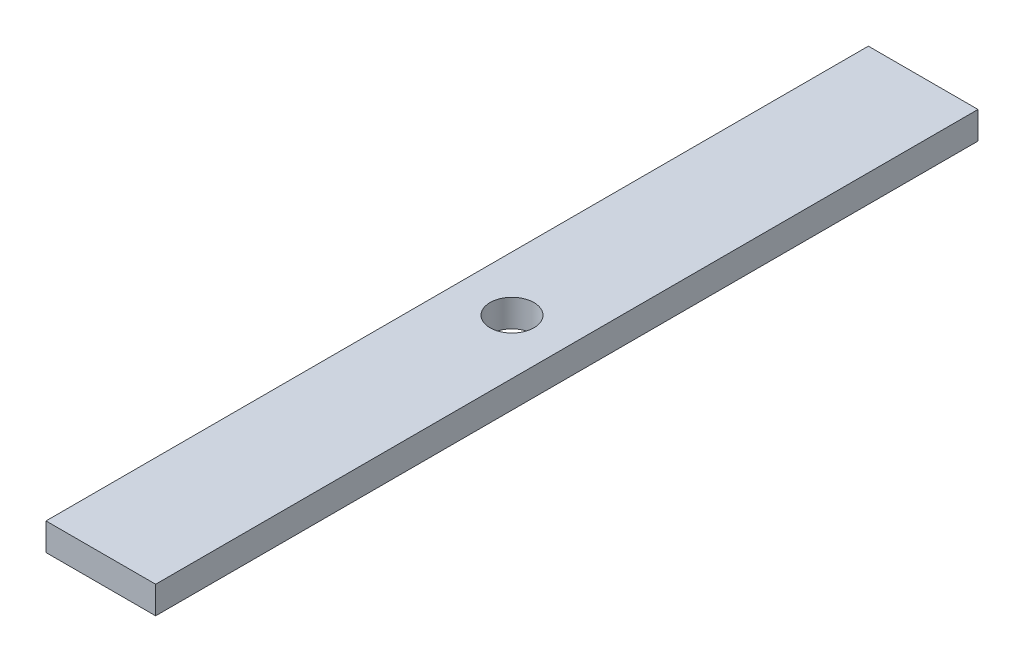
from build123d import *

# Parameters (mm, degrees)
SKETCH1_W                       = 20
SKETCH1_H                       = 5
BOSS_EXTRUDE1_DEPTH             = 106
SKETCH2_R                       = 4
HOLES_FOR_20MM_STRIP_ONLY_DEPTH = 107.587991819
SKETCH5_OUTSIDE_W               = 64.6
SKETCH5_OUTSIDE_H               = 256.6
SKETCH5_OUTSIDE_W_2             = 51.505008444
SKETCH5_OUTSIDE_H_2             = 150
CUT_EXTRUDE3_DEPTH              = 107.587991819


with BuildPart() as part:
    # Sketch1 → Boss-Extrude1 (new, symmetric)
    with BuildSketch(Plane.XY):
        Rectangle(SKETCH1_W, SKETCH1_H)
    extrude(amount=BOSS_EXTRUDE1_DEPTH, both=True)

    # Sketch2 → Holes for 20mm strip ONLY (cut, through all)
    with BuildSketch(Plane(origin=(0, 2.5, 0), x_dir=(1, 0, 0), z_dir=(0, 1, 0))):
        with Locations(Location((0, 87.5, 0), (0, 0, 180))):
            Circle(SKETCH2_R)
        with Locations(Location((0, 0, 0), (0, 0, 180))):
            Circle(SKETCH2_R)
        with Locations(Location((0, -87.5, 0), (0, 0, 180))):
            Circle(SKETCH2_R)
    extrude(amount=-HOLES_FOR_20MM_STRIP_ONLY_DEPTH, mode=Mode.SUBTRACT)

    # Sketch5 outside → Cut-Extrude3 (cut, through all)
    with BuildSketch(Plane(origin=(0, 2.5, 0), x_dir=(1, 0, 0), z_dir=(0, 1, 0))):
        Rectangle(SKETCH5_OUTSIDE_W, SKETCH5_OUTSIDE_H)
        Rectangle(SKETCH5_OUTSIDE_W_2, SKETCH5_OUTSIDE_H_2, mode=Mode.SUBTRACT)
    extrude(amount=-CUT_EXTRUDE3_DEPTH, mode=Mode.SUBTRACT)


solid = part.part
